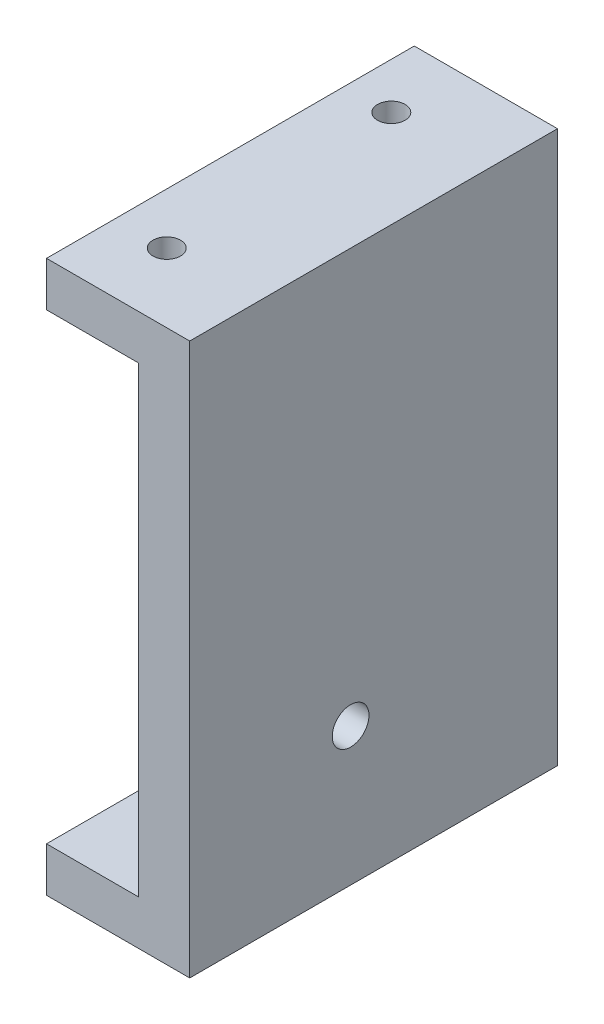
from build123d import *

# Parameters (mm, degrees)
BOSS_EXTRUDE1_DEPTH      = 80
F_6_0_6_DIAMETER_HOLE1_D = 6
F_8_0_8_DIAMETER_HOLE1_D = 8
F_6_0_6_DIAMETER_HOLE2_D = 6


with BuildPart() as part:
    # Sketch2 → Boss-Extrude1 (new body)
    with BuildSketch(Plane.XY):
        Polygon((0, 0), (31.153008197, 0), (31.153008197, 120), (0, 120), (0, 110.293748295), (20, 110.293748295), (20, 9.706251705), (0, 9.706251705), align=None)
    extrude(amount=BOSS_EXTRUDE1_DEPTH)

    # Ø6.0 (6) Diameter Hole1 (through all)
    with Locations(Plane(origin=(0, 120, 0), x_dir=(1, 0, 0), z_dir=(0, 1, 0))):
        with Locations((10, -15)):
            Hole(F_6_0_6_DIAMETER_HOLE1_D / 2)

    # Ø8.0 (8) Diameter Hole1 (through all)
    with Locations(Plane(origin=(31.153008197, 0, 0), x_dir=(0, 0, -1), z_dir=(1, 0, 0))):
        with Locations((-45, 30)):
            Hole(F_8_0_8_DIAMETER_HOLE1_D / 2)

    # Ø6.0 (6) Diameter Hole2 (through all)
    with Locations(Plane(origin=(0, 120, 0), x_dir=(1, 0, 0), z_dir=(0, 1, 0))):
        with Locations((11.153008197, -65)):
            Hole(F_6_0_6_DIAMETER_HOLE2_D / 2)


solid = part.part
